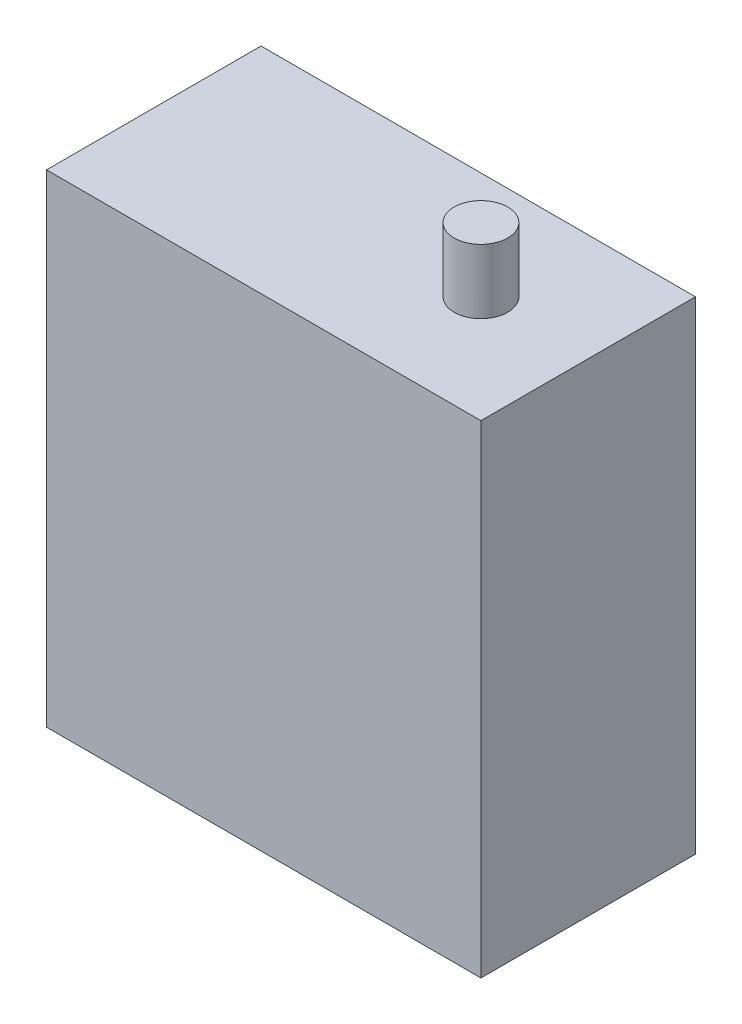
from build123d import *

# Parameters (mm, degrees)
SKETCH1_W           = 40.5
SKETCH1_H           = 45
BOSS_EXTRUDE1_DEPTH = 20
SKETCH2_R           = 2.5
BOSS_EXTRUDE2_DEPTH = 6
SKETCH3_R           = 2.548450287
CUT_EXTRUDE1_DEPTH  = 10


with BuildPart() as part:
    # Sketch1 → Boss-Extrude1 (new body)
    with BuildSketch(Plane.XY):
        Rectangle(SKETCH1_W, SKETCH1_H)
    extrude(amount=BOSS_EXTRUDE1_DEPTH)

    # Sketch2 → Boss-Extrude2 (add)
    with BuildSketch(Plane(origin=(0, 22.5, 0), x_dir=(1, 0, 0), z_dir=(0, 1, 0))):
        with Locations(Location((10.25, -10, 0), (0, 0, 90))):
            Circle(SKETCH2_R)
    extrude(amount=BOSS_EXTRUDE2_DEPTH)

    # Sketch3 → Cut-Extrude1 (cut)
    with BuildSketch(Plane(origin=(0, -22.5, 0), x_dir=(-1, 0, 0), z_dir=(0, -1, 0))):
        with Locations(Location((0, -10, 0), (0, 0, 90))):
            Circle(SKETCH3_R)
    extrude(amount=-CUT_EXTRUDE1_DEPTH, mode=Mode.SUBTRACT)


solid = part.part
